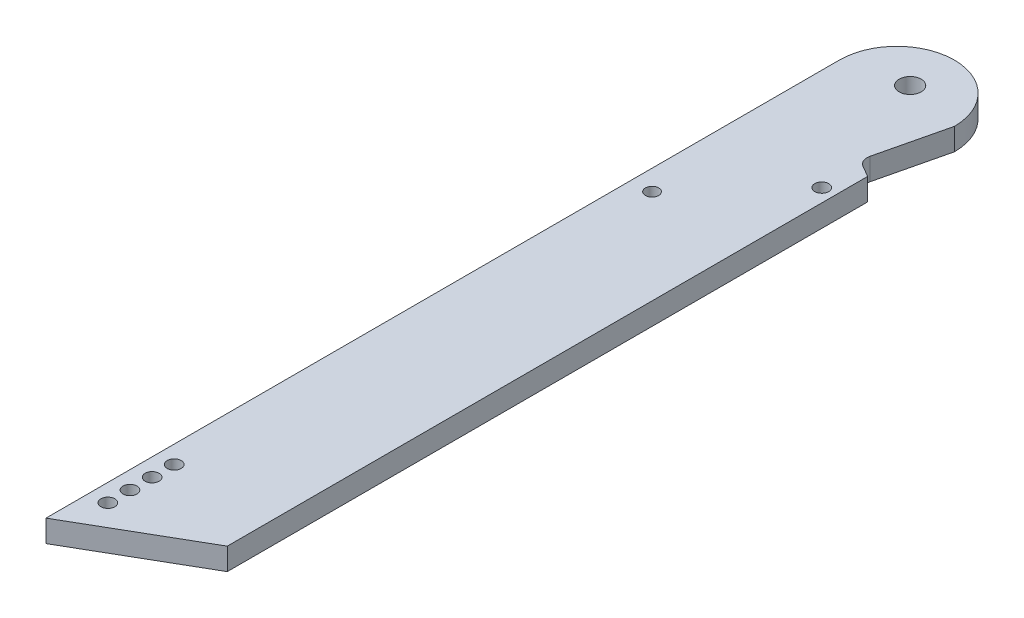
from build123d import *

# Parameters (mm, degrees)
SKETCH2_R           = 3.175
SKETCH2_R_2         = 2
SKETCH2_R_3         = 1.905
BOSS_EXTRUDE1_DEPTH = 6.35


with BuildPart() as part:
    # Sketch2 → Boss-Extrude1 (new body)
    with BuildSketch(Plane(origin=(0, 0, 0), x_dir=(1, 0, 0), z_dir=(0, 1, 0))):
        with BuildLine():
            Line((-16.51, -3.81), (-16.51, -231.775))
            Line((-16.51, -231.775), (16.51, -212.710894111))
            Line((16.51, -212.710894111), (16.51, -28.712717762))
            Line((16.51, -28.712717762), (13.335, -26.879630657))
            ThreePointArc((13.335, -26.879630657), (12.006115832, -25.385120864), (11.834308438, -23.392641284))
            Line((11.834308438, -23.392641284), (16.51, -3.81))
            ThreePointArc((16.51, -3.81), (0, 12.7), (-16.51, -3.81))
        make_face()
        with Locations(Location((0, 0, 0), (0, 0, 270))):
            Circle(SKETCH2_R, mode=Mode.SUBTRACT)
        with Locations(Location((-11.43, -219.075, 0), (0, 0, 270))):
            Circle(SKETCH2_R_2, mode=Mode.SUBTRACT)
        with Locations(Location((-11.43, -212.725, 0), (0, 0, 270))):
            Circle(SKETCH2_R_2, mode=Mode.SUBTRACT)
        with Locations(Location((-11.43, -206.375, 0), (0, 0, 270))):
            Circle(SKETCH2_R_2, mode=Mode.SUBTRACT)
        with Locations(Location((-11.43, -200.025, 0), (0, 0, 270))):
            Circle(SKETCH2_R_2, mode=Mode.SUBTRACT)
        with Locations(Location((-10.6553, -63.5, 0), (0, 0, 270))):
            Circle(SKETCH2_R_3, mode=Mode.SUBTRACT)
        with Locations(Location((12.7, -38.1, 0), (0, 0, 270))):
            Circle(SKETCH2_R_2, mode=Mode.SUBTRACT)
    extrude(amount=BOSS_EXTRUDE1_DEPTH)


solid = part.part
